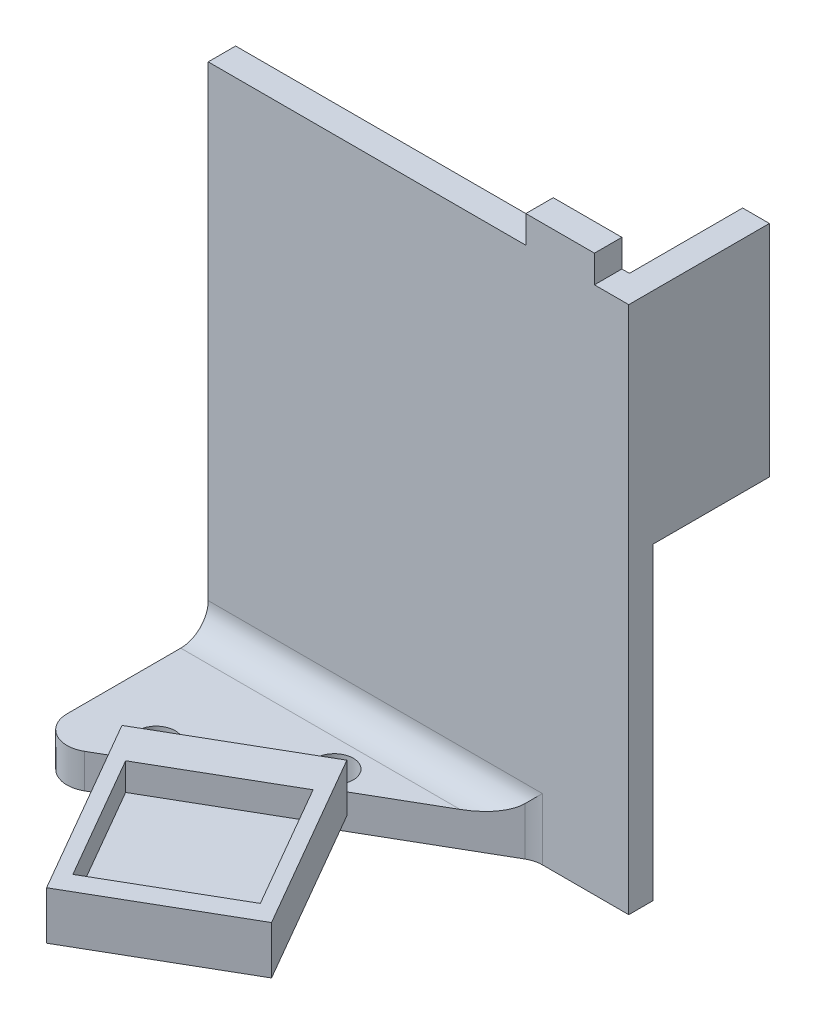
from build123d import *

# Parameters (mm, degrees)
SKETCH1_R           = 2.75
BOSS_EXTRUDE1_DEPTH = 50
SKETCH2_R           = 2.2
BOSS_EXTRUDE2_DEPTH = 5
BOSS_EXTRUDE3_DEPTH = 32
SKETCH4_W           = 31.007197848
SKETCH4_H           = 89.787861365
CUT_EXTRUDE1_DEPTH  = 5
FILLET2_R           = 3
SKETCH6_W           = 76.819231413
SKETCH6_H           = 36.721827539
CUT_EXTRUDE2_DEPTH  = 45
FILLET3_R           = 4
SKETCH7_W           = 24
SKETCH7_H           = 3
BOSS_EXTRUDE4_DEPTH = 30
BOSS_EXTRUDE5_DEPTH = 4
SKETCH9_W           = 70
SKETCH9_H           = 5
CUT_EXTRUDE3_DEPTH  = 30
BOSS_EXTRUDE6_DEPTH = 36


with BuildPart() as part:
    # Sketch1 → Boss-Extrude1 (new body)
    with BuildSketch(Plane(origin=(0, 0, 0), x_dir=(1, 0, 0), z_dir=(0, 1, 0))):
        Polygon((-48.36251287, -26.4206039), (-13.721496719, -26.4206039), (12.928503281, -26.4206039), (12.928503281, -29.9206039), (-0.731115662, -29.9206039), (-48.36251287, -57.4206039), align=None)
        with Locations(Location((-21.908030198, -37.990095825, 0), (0, 0, 270))):
            Circle(SKETCH1_R, mode=Mode.SUBTRACT)
        with Locations(Location((-38.36251287, -47.490095825, 0), (0, 0, 270))):
            Circle(SKETCH1_R, mode=Mode.SUBTRACT)
    extrude(amount=BOSS_EXTRUDE1_DEPTH)

    # Sketch2 → Boss-Extrude2 (add)
    with BuildSketch(Plane(origin=(0, 50, 0), x_dir=(1, 0, 0), z_dir=(0, 1, 0))):
        Polygon((-48.36251287, -26.4206039), (12.928503281, -26.4206039), (12.928503281, -4.4206039), (1.63748713, -4.4206039), (1.63748713, -11.9206039), (-48.36251287, -11.9206039), align=None)
        with Locations(Location((-37.46251287, -15.6206039, 0), (0, 0, 270))):
            Circle(SKETCH2_R, mode=Mode.SUBTRACT)
    extrude(amount=-BOSS_EXTRUDE2_DEPTH)

    # Sketch3 → Boss-Extrude3 (add)
    with BuildSketch(Plane(origin=(0, 50, 0), x_dir=(1, 0, 0), z_dir=(0, 1, 0))):
        Polygon((12.928503281, -4.4206039), (9.028503281, -4.4206039), (9.028503281, -25.9206039), (-48.36251287, -25.9206039), (-48.36251287, -29.9206039), (6.778503281, -29.9206039), (12.928503281, -29.9206039), align=None)
    extrude(amount=BOSS_EXTRUDE3_DEPTH)

    # Sketch4 → Cut-Extrude1 (cut)
    with BuildSketch(Plane(origin=(0, 0, 4.4206039), x_dir=(-1, 0, 0), z_dir=(0, 0, -1))):
        with Locations((-11.123097368, 55.483744722)):
            Rectangle(SKETCH4_W, SKETCH4_H)
    extrude(amount=-CUT_EXTRUDE1_DEPTH, mode=Mode.SUBTRACT)

    # Fillet2
    fillet2_edges = [part.edges().sort_by_distance(p)[0] for p in [
        (-19.667004794, 50, 25.9206039),
        (9.028503281, 50, 17.6706039),
    ]]
    fillet(fillet2_edges, radius=FILLET2_R)

    # Sketch6 → Cut-Extrude2 (cut)
    with BuildSketch(Plane(origin=(0, 50, 0), x_dir=(1, 0, 0), z_dir=(0, 1, 0))):
        with Locations((-17.852673028, -48.28151767)):
            Rectangle(SKETCH6_W, SKETCH6_H)
    extrude(amount=-CUT_EXTRUDE2_DEPTH, mode=Mode.SUBTRACT)

    # Fillet3
    fillet3_edges = [part.edges().sort_by_distance(p)[0] for p in [
        (-0.731115662, 2.5, 29.9206039),
        (-48.36251287, 2.5, 57.4206039),
        (-24.546814266, 5, 29.9206039),
    ]]
    fillet(fillet3_edges, radius=FILLET3_R)

    # Sketch7 → Boss-Extrude4 (add)
    with BuildSketch(Plane(origin=(12.773222622, 0, 22.123870557), x_dir=(0.8660254037844415, 0, -0.49999999999999506), z_dir=(0.49999999999999506, 0, 0.8660254037844415))):
        with Locations((-47.665263456, 3.5)):
            Rectangle(SKETCH7_W, SKETCH7_H)
    extrude(amount=BOSS_EXTRUDE4_DEPTH)

    # Sketch8 → Boss-Extrude5 (add)
    with BuildSketch(Plane(origin=(0, 5, 0), x_dir=(1, 0, 0), z_dir=(0, 1, 0))):
        Polygon((-18.113801564, -39.956502285), (-38.898411255, -51.956502285), (-23.898411255, -77.937264399), (-3.113801564, -65.937264399), align=None)
        Polygon((-23.666360447, -74.339188187), (-6.345852372, -64.339188187), (-16.845852372, -46.152654708), (-34.166360447, -56.152654708), align=None, mode=Mode.SUBTRACT)
    extrude(amount=BOSS_EXTRUDE5_DEPTH)

    # Sketch9 → Cut-Extrude3 (cut)
    with BuildSketch(Plane.XY.offset(29.9206039)):
        with Locations((-13.36251287, 79.5)):
            Rectangle(SKETCH9_W, SKETCH9_H)
    extrude(amount=-CUT_EXTRUDE3_DEPTH, mode=Mode.SUBTRACT)

    # Sketch11 → Boss-Extrude6 (add)
    with BuildSketch(Plane(origin=(0, 45, 0), x_dir=(1, 0, 0), z_dir=(0, 1, 0))):
        Polygon((7.928503281, -29.9206039), (-2.071496719, -29.9206039), (-2.071496719, -27.9206039), (-2.071496719, -25.9206039), (7.928503281, -25.9206039), align=None)
    extrude(amount=BOSS_EXTRUDE6_DEPTH)


solid = part.part
